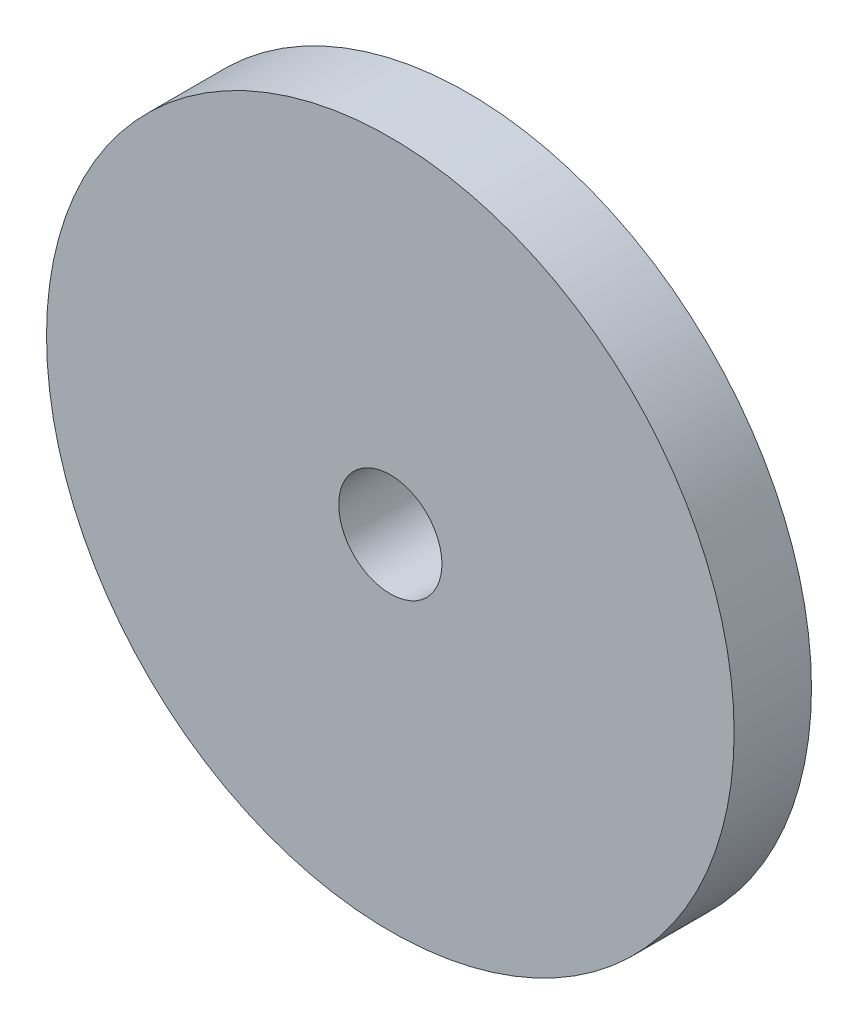
from build123d import *

# Parameters (mm, degrees)
SKETCH1_R           = 100
SKETCH1_R_2         = 15
BOSS_EXTRUDE1_DEPTH = 22.5


with BuildPart() as part:
    # Sketch1 → Boss-Extrude1 (new body)
    with BuildSketch(Plane.XY):
        with Locations(Location((0, 0, 0), (0, 0, 180))):
            Circle(SKETCH1_R)
        with Locations(Location((0, 0, 0), (0, 0, 180))):
            Circle(SKETCH1_R_2, mode=Mode.SUBTRACT)
    extrude(amount=BOSS_EXTRUDE1_DEPTH)


solid = part.part
